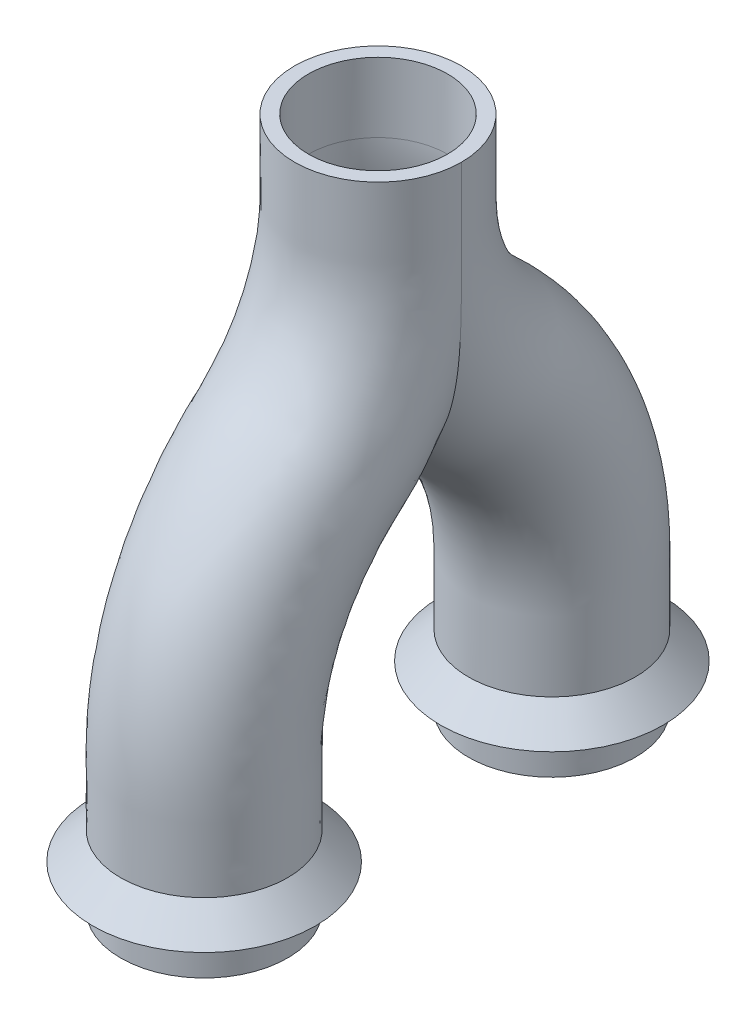
from build123d import *

# Parameters (mm, degrees)
SWEEP1_PROFILE_R     = 6
SWEEP2_PROFILE_R     = 6
CUT_SWEEP1_PROFILE_R = 5
CUT_SWEEP2_PROFILE_R = 5


with BuildPart() as part:
    # Sweep1: sweep along a path in Sketch1
    with BuildLine(Plane(origin=(0, 0, 0), x_dir=(0, 0, -1), z_dir=(1, 0, 0))) as sweep1_path:
        Line((0, 5), (0, 0))
        ThreePointArc((0, 0), (-1.534261237, -7.271825561), (-5.87549411, -13.30399778))
        ThreePointArc((-5.87549411, -13.30399778), (-10.770150151, -20.105155205), (-12.5, -28.30399778))
        Line((-12.5, -28.30399778), (-12.5, -38.30399778))
    # Sweep1 profile (on start of the path) → Sweep1 (sweep)
    with BuildSketch(Plane(origin=(0, 5, 0), x_dir=(0, 0, -1), z_dir=(0, -1, 0))):
        Circle(SWEEP1_PROFILE_R)
    sweep(path=sweep1_path.line)

    # Sweep2: sweep along a path in Sketch3
    with BuildLine(Plane(origin=(0, 0, 0), x_dir=(0, 0, -1), z_dir=(1, 0, 0))) as sweep2_path:
        Line((12.5, -38.30399778), (12.5, -28.30399778))
        ThreePointArc((12.5, -28.30399778), (10.770150151, -20.105155205), (5.87549411, -13.30399778))
        ThreePointArc((5.87549411, -13.30399778), (1.534261237, -7.271825561), (0, 0))
        Line((0, 0), (0, 5))
    # Sweep2 profile (on start of the path) → Sweep2 (sweep)
    with BuildSketch(Plane(origin=(0, -38.30399778, -12.5), x_dir=(0, 0, 1), z_dir=(0, 1, 0))):
        Circle(SWEEP2_PROFILE_R)
    sweep(path=sweep2_path.line)

    # Cut-Sweep1: sweep along a path in Sketch1<5>
    with BuildLine(Plane(origin=(0, 0, 0), x_dir=(0, 0, -1), z_dir=(1, 0, 0))) as cut_sweep1_path:
        Line((0, 5), (0, 0))
        ThreePointArc((0, 0), (-1.534261237, -7.271825561), (-5.87549411, -13.30399778))
        ThreePointArc((-5.87549411, -13.30399778), (-10.770150151, -20.105155205), (-12.5, -28.30399778))
        Line((-12.5, -28.30399778), (-12.5, -38.30399778))
    # Cut-Sweep1 profile (on start of the path) → Cut-Sweep1 (sweep, cut)
    with BuildSketch(Plane(origin=(0, 5, 0), x_dir=(0, 0, -1), z_dir=(0, -1, 0))):
        Circle(CUT_SWEEP1_PROFILE_R)
    sweep(path=cut_sweep1_path.line, mode=Mode.SUBTRACT)

    # Cut-Sweep2: sweep along a path in Sketch3<2>
    with BuildLine(Plane(origin=(0, 0, 0), x_dir=(0, 0, -1), z_dir=(1, 0, 0))) as cut_sweep2_path:
        Line((12.5, -38.30399778), (12.5, -28.30399778))
        ThreePointArc((12.5, -28.30399778), (10.770150151, -20.105155205), (5.87549411, -13.30399778))
        ThreePointArc((5.87549411, -13.30399778), (1.534261237, -7.271825561), (0, 0))
        Line((0, 0), (0, 5))
    # Cut-Sweep2 profile (on start of the path) → Cut-Sweep2 (sweep, cut)
    with BuildSketch(Plane(origin=(0, -38.30399778, -12.5), x_dir=(0, 0, 1), z_dir=(0, 1, 0))):
        Circle(CUT_SWEEP2_PROFILE_R)
    sweep(path=cut_sweep2_path.line, mode=Mode.SUBTRACT)

    # Sketch111 → Revolve1 (revolve)
    with BuildSketch(Plane(origin=(0, 0, 0), x_dir=(0, 0, -1), z_dir=(1, 0, 0))):
        Polygon((6.5, -33.30399778), (4.5, -35.30399778), (6.5, -35.30399778), align=None)
    revolve1 = revolve(axis=Axis((0, -38.30399778, -12.5), (0, 1, 0)))

    # Mirror1: Revolve1 across plane
    add(revolve1.mirror(Plane.XY))


solid = part.part
